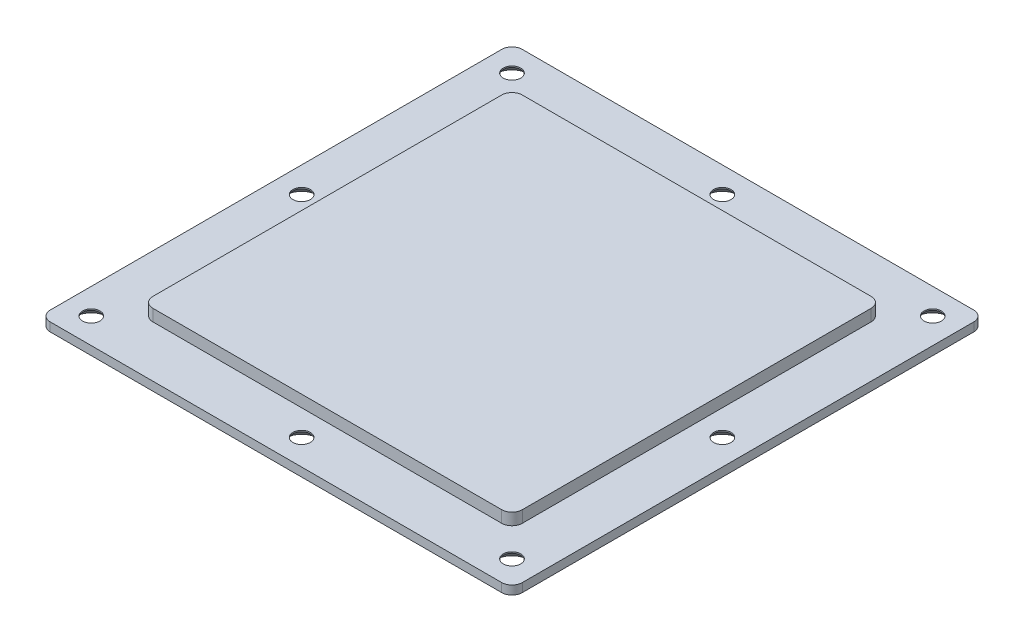
from build123d import *

# Parameters (mm, degrees)
SKETCH1_W                                       = 92
SKETCH1_H                                       = 92
BOSS_EXTRUDE1_DEPTH                             = 0.85
SKETCH2_W                                       = 72
SKETCH2_H                                       = 72
BOSS_EXTRUDE2_DEPTH                             = 2.3
CSK_FOR_M3_FLAT_HEAD_MACHINE_SCREW1_D           = 3.4
CSK_FOR_M3_FLAT_HEAD_MACHINE_SCREW1_CSINK_D     = 6.3
CSK_FOR_M3_FLAT_HEAD_MACHINE_SCREW1_CSINK_ANGLE = 90
FILLET1_R                                       = 2


with BuildPart() as part:
    # Sketch1 → Boss-Extrude1 (new, symmetric)
    with BuildSketch(Plane(origin=(0, 0, 0), x_dir=(1, 0, 0), z_dir=(0, 1, 0))):
        Rectangle(SKETCH1_W, SKETCH1_H)
    extrude(amount=BOSS_EXTRUDE1_DEPTH, both=True)

    # Sketch2 → Boss-Extrude2 (add)
    with BuildSketch(Plane(origin=(0, 0.85, 0), x_dir=(1, 0, 0), z_dir=(0, 1, 0))):
        Rectangle(SKETCH2_W, SKETCH2_H)
    extrude(amount=BOSS_EXTRUDE2_DEPTH)

    # CSK for M3 Flat Head Machine Screw1 (through all)
    with Locations(Plane(origin=(-41, -0.85, 41), x_dir=(0, 0, -1), z_dir=(0, -1, 0))):
        with Locations((0, 0), (0, 41), (0, 82), (41, 82), (82, 82), (82, 41), (82, 0), (41, 0)):
            CounterSinkHole(CSK_FOR_M3_FLAT_HEAD_MACHINE_SCREW1_D / 2, CSK_FOR_M3_FLAT_HEAD_MACHINE_SCREW1_CSINK_D / 2, counter_sink_angle=CSK_FOR_M3_FLAT_HEAD_MACHINE_SCREW1_CSINK_ANGLE)

    # Fillet1
    fillet1_edges = [part.edges().sort_by_distance(p)[0] for p in [
        (36, 2, 36),
        (36, 2, -36),
        (-36, 2, -36),
        (-36, 2, 36),
        (46, 0, 46),
        (-46, 0, 46),
        (-46, 0, -46),
        (46, 0, -46),
    ]]
    fillet(fillet1_edges, radius=FILLET1_R)


solid = part.part
